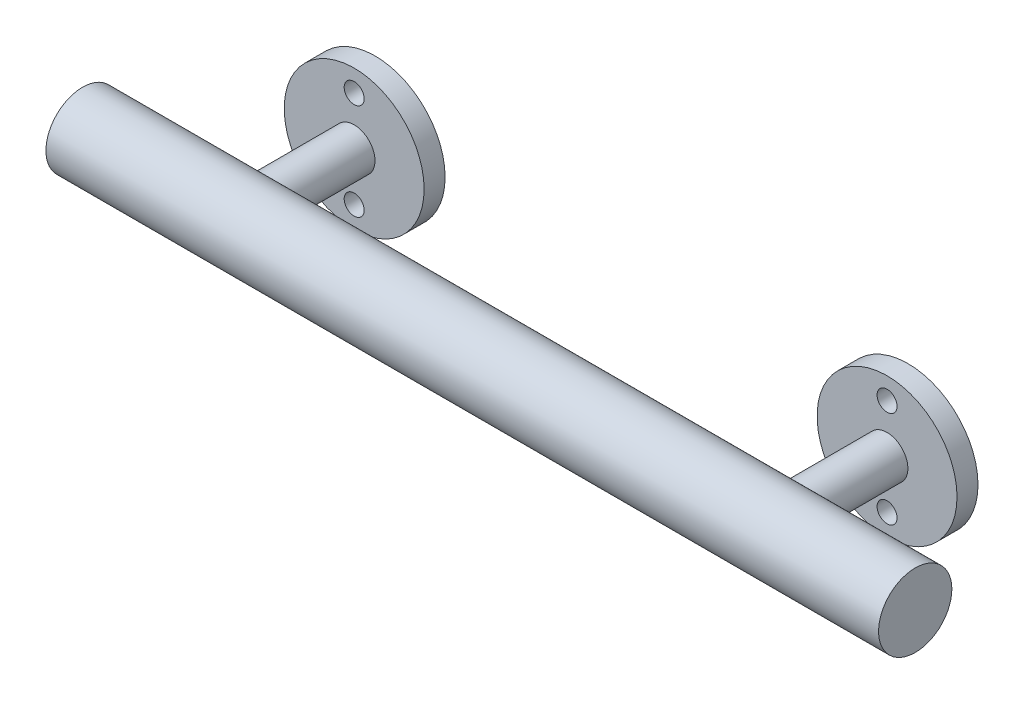
from build123d import *

# Parameters (mm, degrees)
SKETCH_1_R           = 21
EXTRUDE_3_DEPTH      = 6.3
EXTRUDE_3_2_DEPTH    = 6.3
SKETCH_3_R           = 6.25
EXTRUDE_4_DEPTH      = 33
EXTRUDE_5_DEPTH      = 140
EXTRUDE_5_DEPTH_BACK = 110
SKETCH_4_R           = 11
SKETCH_5_R           = 3
CUT_EXTRUDE_1_DEPTH  = 10


with BuildPart() as part:
    # 草圖1 → 填料-伸長3 (new body)
    with BuildSketch(Plane.XY):
        with Locations((-64.202643172, 0)):
            Circle(SKETCH_1_R)
    extrude(amount=EXTRUDE_3_DEPTH)



with BuildPart() as body_2:
    # 草圖1 → Extrude 3 2 (new body)
    with BuildSketch(Plane.XY):
        with Locations((95.797356828, 0)):
            Circle(SKETCH_1_R)
    extrude(amount=EXTRUDE_3_2_DEPTH)


with BuildPart() as part_1:
    add(part.part)

    add(body_2.part)  # 填料-伸長4 merges body 2
    # 草圖3 → 填料-伸長4 (add)
    with BuildSketch(Plane.XY):
        with Locations((-64.202643172, 0)):
            Circle(SKETCH_3_R)
        with Locations((95.797356828, 0)):
            Circle(SKETCH_3_R)
    extrude(amount=EXTRUDE_4_DEPTH)

    # 草圖4 → 填料-伸長5 (add, two sides: drawn at the far end of the back side and taken through both)
    with BuildSketch(Plane(origin=(0, 0, 0), x_dir=(0, 0, -1), z_dir=(1, 0, 0)).offset(-EXTRUDE_5_DEPTH_BACK)):
        with Locations((-42.051933495, 0)):
            Circle(SKETCH_4_R)
    extrude(amount=EXTRUDE_5_DEPTH + EXTRUDE_5_DEPTH_BACK)

    # 草圖5 → 除料-伸長1 (cut)
    with BuildSketch(Plane.XY.offset(6.3)):
        with Locations((-64.202643172, 14.5)):
            Circle(SKETCH_5_R)
        with Locations((-64.202643172, -14.5)):
            Circle(SKETCH_5_R)
        with Locations((95.797356828, 14.5)):
            Circle(SKETCH_5_R)
        with Locations((95.797356828, -14.5)):
            Circle(SKETCH_5_R)
    extrude(amount=-CUT_EXTRUDE_1_DEPTH, mode=Mode.SUBTRACT)


solid = part_1.part
